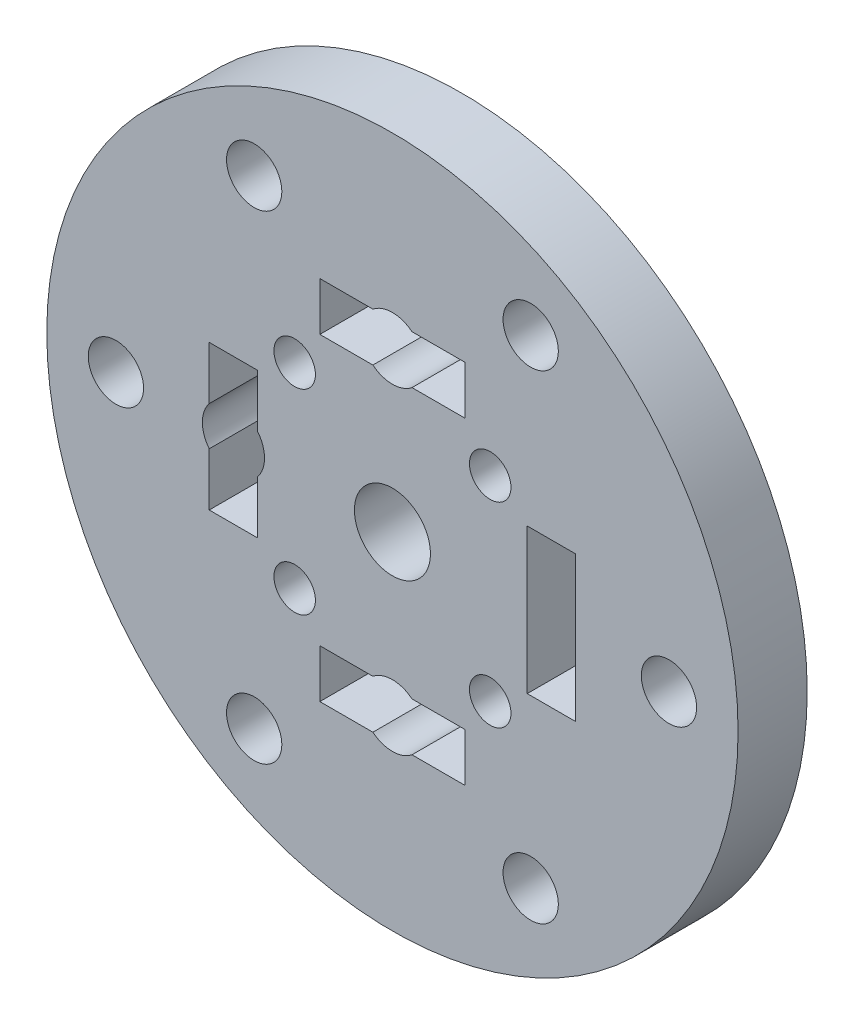
from build123d import *

# Parameters (mm, degrees)
SKETCH_1_R          = 25
SKETCH_1_W          = 3
SKETCH_1_H          = 10
SKETCH_1_R_2        = 2
SKETCH_1_R_3        = 1.5
SKETCH_1_R_4        = 2.75
EXTRUDE_1_DEPTH     = 5
CUT_EXTRUDE_START   = -10
SKETCH_3_W          = 3.5
SKETCH_3_H          = 10.5
SKETCH_3_W_2        = 3
SKETCH_3_H_2        = 10
CUT_EXTRUDE_1_DEPTH = 10


with BuildPart() as part:
    # 草图1 → 凸台-拉伸1 (new body)
    with BuildSketch(Plane.XY):
        Circle(SKETCH_1_R)
        with Locations((11.5, 0)):
            Rectangle(SKETCH_1_W, SKETCH_1_H, mode=Mode.SUBTRACT)
        with Locations((-10, -17.320508076)):
            Circle(SKETCH_1_R_2, mode=Mode.SUBTRACT)
        with Locations((-7.071067812, -7.071067812)):
            Circle(SKETCH_1_R_3, mode=Mode.SUBTRACT)
        with BuildLine():
            Line((-10, -1.322875656), (-10, -5))
            Line((-10, -5), (-13, -5))
            Line((-13, -5), (-13, -1.322875656))
            ThreePointArc((-13, -1.322875656), (-13.5, 0), (-13, 1.322875656))
            Line((-13, 1.322875656), (-13, 5))
            Line((-13, 5), (-10, 5))
            Line((-10, 5), (-10, 1.322875656))
            ThreePointArc((-10, 1.322875656), (-9.5, 0), (-10, -1.322875656))
        make_face(mode=Mode.SUBTRACT)
        with Locations((10, -17.320508076)):
            Circle(SKETCH_1_R_2, mode=Mode.SUBTRACT)
        with BuildLine():
            Line((1.322875656, -10), (5, -10))
            Line((5, -10), (5, -13))
            Line((5, -13), (1.322875656, -13))
            ThreePointArc((1.322875656, -13), (0, -13.5), (-1.322875656, -13))
            Line((-1.322875656, -13), (-5, -13))
            Line((-5, -13), (-5, -10))
            Line((-5, -10), (-1.322875656, -10))
            ThreePointArc((-1.322875656, -10), (0, -9.5), (1.322875656, -10))
        make_face(mode=Mode.SUBTRACT)
        with Locations((7.071067812, -7.071067812)):
            Circle(SKETCH_1_R_3, mode=Mode.SUBTRACT)
        with Locations((-20, 0)):
            Circle(SKETCH_1_R_2, mode=Mode.SUBTRACT)
        with Locations((-7.071067812, 7.071067812)):
            Circle(SKETCH_1_R_3, mode=Mode.SUBTRACT)
        with BuildLine():
            Line((-1.322875656, 10), (-5, 10))
            Line((-5, 10), (-5, 13))
            Line((-5, 13), (-1.322875656, 13))
            ThreePointArc((-1.322875656, 13), (0, 13.5), (1.322875656, 13))
            Line((1.322875656, 13), (5, 13))
            Line((5, 13), (5, 10))
            Line((5, 10), (1.322875656, 10))
            ThreePointArc((1.322875656, 10), (0, 9.5), (-1.322875656, 10))
        make_face(mode=Mode.SUBTRACT)
        with Locations((-10, 17.320508076)):
            Circle(SKETCH_1_R_2, mode=Mode.SUBTRACT)
        Circle(SKETCH_1_R_4, mode=Mode.SUBTRACT)
        with Locations((10, 17.320508076)):
            Circle(SKETCH_1_R_2, mode=Mode.SUBTRACT)
        with Locations((7.071067812, 7.071067812)):
            Circle(SKETCH_1_R_3, mode=Mode.SUBTRACT)
        with Locations((20, 0)):
            Circle(SKETCH_1_R_2, mode=Mode.SUBTRACT)
    extrude(amount=EXTRUDE_1_DEPTH)

    # 草图3 → 切除-拉伸1 (cut)
    # profile 1 of 4: a face of its own
    with BuildSketch(Plane.XY.offset(5).offset(CUT_EXTRUDE_START)):
        with BuildLine():
            Line((-5.25, 9.75), (-5.25, 13.25))
            Line((-5.25, 13.25), (-1.414213562, 13.25))
            ThreePointArc((-1.414213562, 13.25), (0, 13.75), (1.414213562, 13.25))
            Line((1.414213562, 13.25), (5.25, 13.25))
            Line((5.25, 13.25), (5.25, 9.75))
            Line((5.25, 9.75), (1.414213562, 9.75))
            ThreePointArc((1.414213562, 9.75), (0, 9.25), (-1.414213562, 9.75))
            Line((-1.414213562, 9.75), (-5.25, 9.75))
        make_face()
        with BuildLine():
            Line((-5, 10), (-5, 13))
            Line((-5, 13), (-1.322875656, 13))
            ThreePointArc((-1.322875656, 13), (0, 13.5), (1.322875656, 13))
            Line((1.322875656, 13), (5, 13))
            Line((5, 13), (5, 10))
            Line((5, 10), (1.322875656, 10))
            ThreePointArc((1.322875656, 10), (0, 9.5), (-1.322875656, 10))
            Line((-1.322875656, 10), (-5, 10))
        make_face(mode=Mode.SUBTRACT)
    # profile 2 of 4: a face of its own
    with BuildSketch(Plane.XY.offset(5).offset(CUT_EXTRUDE_START)):
        with BuildLine():
            Line((-13.25, -5.25), (-13.25, -1.414213562))
            ThreePointArc((-13.25, -1.414213562), (-13.75, 0), (-13.25, 1.414213562))
            Line((-13.25, 1.414213562), (-13.25, 5.25))
            Line((-13.25, 5.25), (-9.75, 5.25))
            Line((-9.75, 5.25), (-9.75, 1.414213562))
            ThreePointArc((-9.75, 1.414213562), (-9.25, 0), (-9.75, -1.414213562))
            Line((-9.75, -1.414213562), (-9.75, -5.25))
            Line((-9.75, -5.25), (-13.25, -5.25))
        make_face()
        with BuildLine():
            Line((-13, -5), (-13, -1.322875656))
            ThreePointArc((-13, -1.322875656), (-13.5, 0), (-13, 1.322875656))
            Line((-13, 1.322875656), (-13, 5))
            Line((-13, 5), (-10, 5))
            Line((-10, 5), (-10, 1.322875656))
            ThreePointArc((-10, 1.322875656), (-9.5, 0), (-10, -1.322875656))
            Line((-10, -1.322875656), (-10, -5))
            Line((-10, -5), (-13, -5))
        make_face(mode=Mode.SUBTRACT)
    # profile 3 of 4: a face of its own
    with BuildSketch(Plane.XY.offset(5).offset(CUT_EXTRUDE_START)):
        with BuildLine():
            Line((5.25, -9.75), (1.414213562, -9.75))
            ThreePointArc((1.414213562, -9.75), (0, -9.25), (-1.414213562, -9.75))
            Line((-1.414213562, -9.75), (-5.25, -9.75))
            Line((-5.25, -9.75), (-5.25, -13.25))
            Line((-5.25, -13.25), (-1.414213562, -13.25))
            ThreePointArc((-1.414213562, -13.25), (0, -13.75), (1.414213562, -13.25))
            Line((1.414213562, -13.25), (5.25, -13.25))
            Line((5.25, -13.25), (5.25, -9.75))
        make_face()
        with BuildLine():
            Line((5, -10), (1.322875656, -10))
            ThreePointArc((1.322875656, -10), (0, -9.5), (-1.322875656, -10))
            Line((-1.322875656, -10), (-5, -10))
            Line((-5, -10), (-5, -13))
            Line((-5, -13), (-1.322875656, -13))
            ThreePointArc((-1.322875656, -13), (0, -13.5), (1.322875656, -13))
            Line((1.322875656, -13), (5, -13))
            Line((5, -13), (5, -10))
        make_face(mode=Mode.SUBTRACT)
    # profile 4 of 4: a face of its own
    with BuildSketch(Plane.XY.offset(5).offset(CUT_EXTRUDE_START)):
        with Locations((11.5, 0)):
            Rectangle(SKETCH_3_W, SKETCH_3_H)
        with Locations((11.5, 0)):
            Rectangle(SKETCH_3_W_2, SKETCH_3_H_2, mode=Mode.SUBTRACT)
    extrude(amount=CUT_EXTRUDE_1_DEPTH, mode=Mode.SUBTRACT)


solid = part.part
